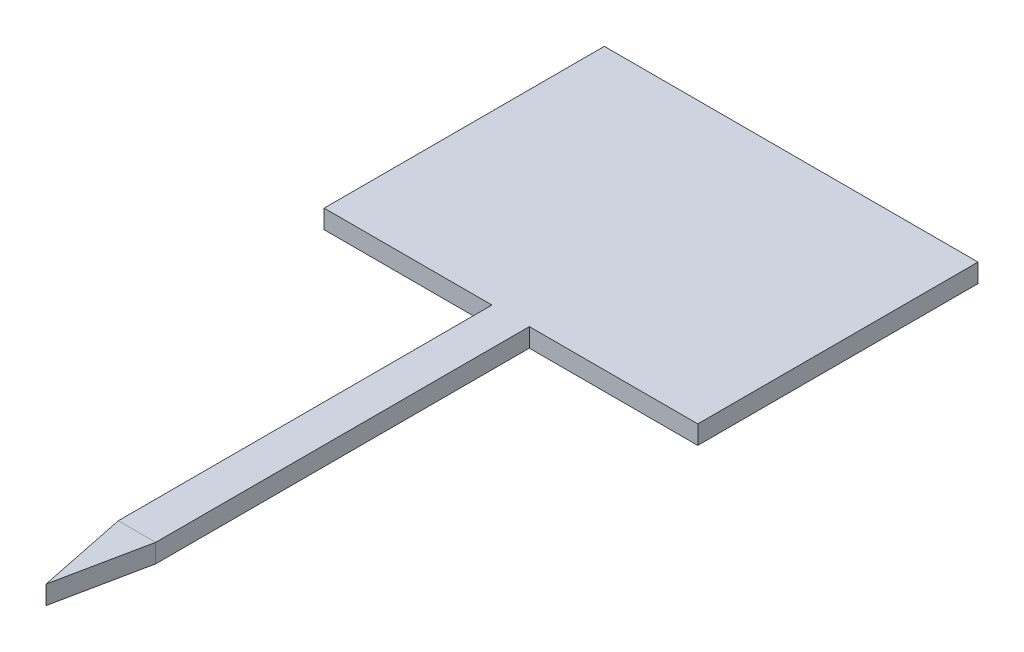
from build123d import *

# Parameters (mm, degrees)
SKETCH1_W           = 0.4
SKETCH1_H           = 4
SKETCH1_W_2         = 4
SKETCH1_H_2         = 3
BOSS_EXTRUDE1_DEPTH = 0.2
BOSS_EXTRUDE3_START = -0.2
BOSS_EXTRUDE3_DEPTH = 0.200006


with BuildPart() as part:
    # Sketch1 → Boss-Extrude1 (new body)
    with BuildSketch(Plane(origin=(0, 0, 0), x_dir=(1, 0, 0), z_dir=(0, 1, 0))):
        with Locations((3.376311417, -1.321333446)):
            Rectangle(SKETCH1_W, SKETCH1_H)
        with Locations((3.379701823, 2.178666554)):
            Rectangle(SKETCH1_W_2, SKETCH1_H_2)
    extrude(amount=BOSS_EXTRUDE1_DEPTH)

    # Sketch5 → Boss-Extrude3 (add)
    with BuildSketch(Plane(origin=(0, 0.2, 0), x_dir=(1, 0, 0), z_dir=(0, 1, 0)).offset(BOSS_EXTRUDE3_START)):
        Polygon((3.176311417, -3.321333446), (3.576311417, -3.321333446), (3.376311417, -4.295422221), align=None)
    extrude(amount=BOSS_EXTRUDE3_DEPTH)


solid = part.part
